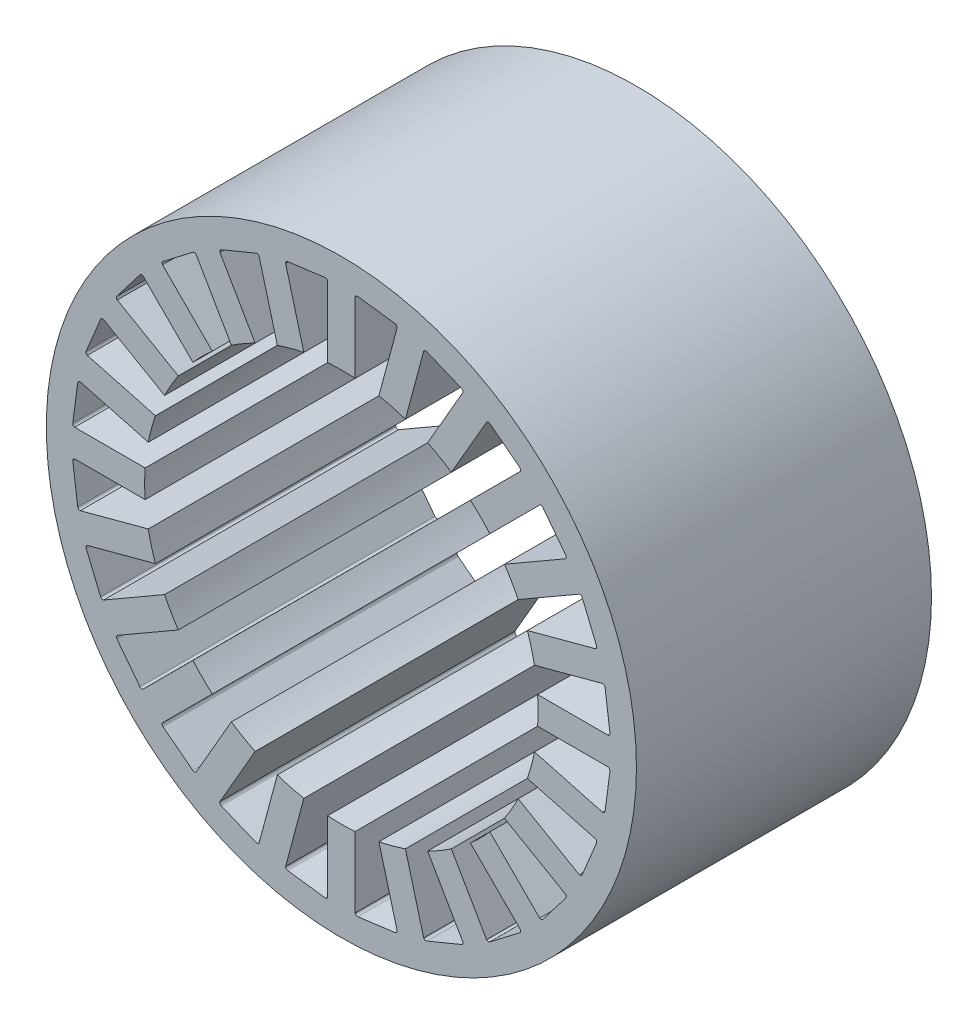
from build123d import *

# Parameters (mm, degrees)
MODEL_R             = 135
BOSS_EXTRUDE1_DEPTH = 135


with BuildPart() as part:
    # Model → Boss-Extrude1 (new body)
    with BuildSketch(Plane.XY):
        Circle(MODEL_R)
        with BuildLine():
            Line((6.278084557, 89.780764389), (6.278084557, 122.02904248))
            ThreePointArc((6.278084557, 122.02904248), (6.722159271, 122.686496505), (7.489003639, 122.889961149))
            Line((7.489003639, 122.889961149), (24.57244037, 120.640884036))
            ThreePointArc((24.57244037, 120.640884036), (25.260494624, 120.245878355), (25.519276236, 119.495891539))
            Line((25.519276236, 119.495891539), (17.172807695, 88.346446878))
            ThreePointArc((17.172807695, 88.346446878), (23.293714059, 86.933324366), (29.301135721, 85.096671177))
            Line((29.301135721, 85.096671177), (37.647604263, 116.246115839))
            ThreePointArc((37.647604263, 116.246115839), (38.24670912, 116.766232668), (39.040084425, 116.764290495))
            Line((39.040084425, 116.764290495), (54.959313175, 110.170330045))
            ThreePointArc((54.959313175, 110.170330045), (55.521687556, 109.61070231), (55.577540527, 108.819293066))
            Line((55.577540527, 108.819293066), (39.453401481, 80.891465011))
            ThreePointArc((39.453401481, 80.891465011), (45, 77.942286341), (50.327362908, 74.613380454))
            Line((50.327362908, 74.613380454), (66.451501953, 102.541208509))
            ThreePointArc((66.451501953, 102.541208509), (67.164808949, 102.888543039), (67.930647975, 102.681326406))
            Line((67.930647975, 102.681326406), (81.600799611, 92.191850126))
            ThreePointArc((81.600799611, 92.191850126), (81.999169234, 91.505738043), (81.848287277, 90.726839603))
            Line((81.848287277, 90.726839603), (59.045311157, 67.923863483))
            ThreePointArc((59.045311157, 67.923863483), (63.639610307, 63.639610307), (67.923863483, 59.045311157))
            Line((67.923863483, 59.045311157), (90.726839602, 81.848287277))
            ThreePointArc((90.726839602, 81.848287277), (91.505738043, 81.999169234), (92.191850126, 81.600799611))
            Line((92.191850126, 81.600799611), (102.681326406, 67.930647975))
            ThreePointArc((102.681326406, 67.930647975), (102.888543039, 67.164808949), (102.541208509, 66.451501953))
            Line((102.541208509, 66.451501953), (74.613380454, 50.327362908))
            ThreePointArc((74.613380454, 50.327362908), (77.942286341, 45), (80.89146501, 39.453401482))
            Line((80.89146501, 39.453401482), (108.819293066, 55.577540527))
            ThreePointArc((108.819293066, 55.577540527), (109.61070231, 55.521687556), (110.170330045, 54.959313175))
            Line((110.170330045, 54.959313175), (116.764290495, 39.040084425))
            ThreePointArc((116.764290495, 39.040084425), (116.766232668, 38.24670912), (116.246115839, 37.647604263))
            Line((116.246115839, 37.647604263), (85.096671177, 29.301135721))
            ThreePointArc((85.096671177, 29.301135721), (86.933324366, 23.293714059), (88.346446877, 17.172807695))
            Line((88.346446877, 17.172807695), (119.495891539, 25.519276237))
            ThreePointArc((119.495891539, 25.519276237), (120.245878355, 25.260494625), (120.640884036, 24.57244037))
            Line((120.640884036, 24.57244037), (122.889961149, 7.489003639))
            ThreePointArc((122.889961149, 7.489003639), (122.686496505, 6.722159271), (122.02904248, 6.278084557))
            Line((122.02904248, 6.278084557), (89.780764389, 6.278084557))
            ThreePointArc((89.780764389, 6.278084557), (89.945174398, 3.140955665), (90, 0))
            ThreePointArc((90, 0), (89.945174398, -3.140955665), (89.780764389, -6.278084557))
            Line((89.780764389, -6.278084557), (122.02904248, -6.278084557))
            ThreePointArc((122.02904248, -6.278084557), (122.686496505, -6.722159271), (122.889961149, -7.489003639))
            Line((122.889961149, -7.489003639), (120.640884036, -24.57244037))
            ThreePointArc((120.640884036, -24.57244037), (120.245878355, -25.260494624), (119.495891539, -25.519276236))
            Line((119.495891539, -25.519276236), (88.346446878, -17.172807695))
            ThreePointArc((88.346446878, -17.172807695), (86.933324366, -23.293714059), (85.096671177, -29.301135721))
            Line((85.096671177, -29.301135721), (116.246115839, -37.647604263))
            ThreePointArc((116.246115839, -37.647604263), (116.766232668, -38.24670912), (116.764290495, -39.040084425))
            Line((116.764290495, -39.040084425), (110.170330045, -54.959313175))
            ThreePointArc((110.170330045, -54.959313175), (109.61070231, -55.521687556), (108.819293066, -55.577540527))
            Line((108.819293066, -55.577540527), (80.891465011, -39.453401481))
            ThreePointArc((80.891465011, -39.453401481), (77.942286341, -45), (74.613380454, -50.327362908))
            Line((74.613380454, -50.327362908), (102.541208509, -66.451501953))
            ThreePointArc((102.541208509, -66.451501953), (102.888543039, -67.164808949), (102.681326406, -67.930647975))
            Line((102.681326406, -67.930647975), (92.191850126, -81.600799611))
            ThreePointArc((92.191850126, -81.600799611), (91.505738043, -81.999169234), (90.726839603, -81.848287277))
            Line((90.726839603, -81.848287277), (67.923863483, -59.045311157))
            ThreePointArc((67.923863483, -59.045311157), (63.639610307, -63.639610307), (59.045311157, -67.923863483))
            Line((59.045311157, -67.923863483), (81.848287277, -90.726839602))
            ThreePointArc((81.848287277, -90.726839602), (81.999169234, -91.505738043), (81.600799611, -92.191850126))
            Line((81.600799611, -92.191850126), (67.930647975, -102.681326406))
            ThreePointArc((67.930647975, -102.681326406), (67.164808949, -102.888543039), (66.451501953, -102.541208509))
            Line((66.451501953, -102.541208509), (50.327362908, -74.613380454))
            ThreePointArc((50.327362908, -74.613380454), (45, -77.942286341), (39.453401481, -80.89146501))
            Line((39.453401481, -80.89146501), (55.577540527, -108.819293066))
            ThreePointArc((55.577540527, -108.819293066), (55.521687556, -109.61070231), (54.959313175, -110.170330045))
            Line((54.959313175, -110.170330045), (39.040084425, -116.764290495))
            ThreePointArc((39.040084425, -116.764290495), (38.24670912, -116.766232668), (37.647604263, -116.246115839))
            Line((37.647604263, -116.246115839), (29.301135721, -85.096671177))
            ThreePointArc((29.301135721, -85.096671177), (23.293714059, -86.933324366), (17.172807695, -88.346446877))
            Line((17.172807695, -88.346446877), (25.519276237, -119.495891539))
            ThreePointArc((25.519276237, -119.495891539), (25.260494625, -120.245878355), (24.57244037, -120.640884036))
            Line((24.57244037, -120.640884036), (7.489003639, -122.889961149))
            ThreePointArc((7.489003639, -122.889961149), (6.722159271, -122.686496505), (6.278084557, -122.02904248))
            Line((6.278084557, -122.02904248), (6.278084557, -89.780764389))
            ThreePointArc((6.278084557, -89.780764389), (3.140955665, -89.945174398), (0, -90))
            ThreePointArc((0, -90), (-3.140955665, -89.945174398), (-6.278084557, -89.780764389))
            Line((-6.278084557, -89.780764389), (-6.278084557, -122.02904248))
            ThreePointArc((-6.278084557, -122.02904248), (-6.722159271, -122.686496505), (-7.489003639, -122.889961149))
            Line((-7.489003639, -122.889961149), (-24.57244037, -120.640884036))
            ThreePointArc((-24.57244037, -120.640884036), (-25.260494624, -120.245878355), (-25.519276236, -119.495891539))
            Line((-25.519276236, -119.495891539), (-17.172807695, -88.346446878))
            ThreePointArc((-17.172807695, -88.346446878), (-23.293714059, -86.933324366), (-29.301135721, -85.096671177))
            Line((-29.301135721, -85.096671177), (-37.647604263, -116.246115839))
            ThreePointArc((-37.647604263, -116.246115839), (-38.24670912, -116.766232668), (-39.040084425, -116.764290495))
            Line((-39.040084425, -116.764290495), (-54.959313175, -110.170330045))
            ThreePointArc((-54.959313175, -110.170330045), (-55.521687556, -109.61070231), (-55.577540527, -108.819293066))
            Line((-55.577540527, -108.819293066), (-39.453401481, -80.891465011))
            ThreePointArc((-39.453401481, -80.891465011), (-45, -77.942286341), (-50.327362908, -74.613380454))
            Line((-50.327362908, -74.613380454), (-66.451501953, -102.541208509))
            ThreePointArc((-66.451501953, -102.541208509), (-67.164808949, -102.888543039), (-67.930647975, -102.681326406))
            Line((-67.930647975, -102.681326406), (-81.600799611, -92.191850126))
            ThreePointArc((-81.600799611, -92.191850126), (-81.999169234, -91.505738043), (-81.848287277, -90.726839603))
            Line((-81.848287277, -90.726839603), (-59.045311157, -67.923863483))
            ThreePointArc((-59.045311157, -67.923863483), (-63.639610307, -63.639610307), (-67.923863483, -59.045311157))
            Line((-67.923863483, -59.045311157), (-90.726839602, -81.848287277))
            ThreePointArc((-90.726839602, -81.848287277), (-91.505738043, -81.999169234), (-92.191850126, -81.600799611))
            Line((-92.191850126, -81.600799611), (-102.681326406, -67.930647975))
            ThreePointArc((-102.681326406, -67.930647975), (-102.888543039, -67.164808949), (-102.541208509, -66.451501953))
            Line((-102.541208509, -66.451501953), (-74.613380454, -50.327362908))
            ThreePointArc((-74.613380454, -50.327362908), (-77.942286341, -45), (-80.89146501, -39.453401481))
            Line((-80.89146501, -39.453401481), (-108.819293066, -55.577540527))
            ThreePointArc((-108.819293066, -55.577540527), (-109.61070231, -55.521687556), (-110.170330045, -54.959313175))
            Line((-110.170330045, -54.959313175), (-116.764290495, -39.040084425))
            ThreePointArc((-116.764290495, -39.040084425), (-116.766232668, -38.24670912), (-116.246115839, -37.647604263))
            Line((-116.246115839, -37.647604263), (-85.096671177, -29.301135721))
            ThreePointArc((-85.096671177, -29.301135721), (-86.933324366, -23.293714059), (-88.346446877, -17.172807695))
            Line((-88.346446877, -17.172807695), (-119.495891539, -25.519276237))
            ThreePointArc((-119.495891539, -25.519276237), (-120.245878355, -25.260494625), (-120.640884036, -24.57244037))
            Line((-120.640884036, -24.57244037), (-122.889961149, -7.489003639))
            ThreePointArc((-122.889961149, -7.489003639), (-122.686496505, -6.722159271), (-122.02904248, -6.278084557))
            Line((-122.02904248, -6.278084557), (-89.780764389, -6.278084557))
            ThreePointArc((-89.780764389, -6.278084557), (-89.945174398, -3.140955665), (-90, 0))
            ThreePointArc((-90, 0), (-89.945174398, 3.140955665), (-89.780764389, 6.278084557))
            Line((-89.780764389, 6.278084557), (-122.02904248, 6.278084557))
            ThreePointArc((-122.02904248, 6.278084557), (-122.686496505, 6.722159271), (-122.889961149, 7.489003639))
            Line((-122.889961149, 7.489003639), (-120.640884036, 24.57244037))
            ThreePointArc((-120.640884036, 24.57244037), (-120.245878355, 25.260494624), (-119.495891539, 25.519276236))
            Line((-119.495891539, 25.519276236), (-88.346446878, 17.172807695))
            ThreePointArc((-88.346446878, 17.172807695), (-86.933324366, 23.293714059), (-85.096671177, 29.301135721))
            Line((-85.096671177, 29.301135721), (-116.246115839, 37.647604263))
            ThreePointArc((-116.246115839, 37.647604263), (-116.766232668, 38.24670912), (-116.764290495, 39.040084425))
            Line((-116.764290495, 39.040084425), (-110.170330045, 54.959313175))
            ThreePointArc((-110.170330045, 54.959313175), (-109.61070231, 55.521687556), (-108.819293066, 55.577540527))
            Line((-108.819293066, 55.577540527), (-80.891465011, 39.453401481))
            ThreePointArc((-80.891465011, 39.453401481), (-77.942286341, 45), (-74.613380454, 50.327362908))
            Line((-74.613380454, 50.327362908), (-102.541208509, 66.451501953))
            ThreePointArc((-102.541208509, 66.451501953), (-102.888543039, 67.164808949), (-102.681326406, 67.930647975))
            Line((-102.681326406, 67.930647975), (-92.191850126, 81.600799611))
            ThreePointArc((-92.191850126, 81.600799611), (-91.505738043, 81.999169234), (-90.726839603, 81.848287277))
            Line((-90.726839603, 81.848287277), (-67.923863483, 59.045311157))
            ThreePointArc((-67.923863483, 59.045311157), (-63.639610307, 63.639610307), (-59.045311157, 67.923863483))
            Line((-59.045311157, 67.923863483), (-81.848287277, 90.726839602))
            ThreePointArc((-81.848287277, 90.726839602), (-81.999169234, 91.505738043), (-81.600799611, 92.191850126))
            Line((-81.600799611, 92.191850126), (-67.930647975, 102.681326406))
            ThreePointArc((-67.930647975, 102.681326406), (-67.164808949, 102.888543039), (-66.451501953, 102.541208509))
            Line((-66.451501953, 102.541208509), (-50.327362908, 74.613380454))
            ThreePointArc((-50.327362908, 74.613380454), (-45, 77.942286341), (-39.453401482, 80.89146501))
            Line((-39.453401482, 80.89146501), (-55.577540527, 108.819293066))
            ThreePointArc((-55.577540527, 108.819293066), (-55.521687556, 109.61070231), (-54.959313175, 110.170330045))
            Line((-54.959313175, 110.170330045), (-39.040084425, 116.764290495))
            ThreePointArc((-39.040084425, 116.764290495), (-38.24670912, 116.766232668), (-37.647604263, 116.246115839))
            Line((-37.647604263, 116.246115839), (-29.301135721, 85.096671177))
            ThreePointArc((-29.301135721, 85.096671177), (-23.293714059, 86.933324366), (-17.172807695, 88.346446877))
            Line((-17.172807695, 88.346446877), (-25.519276237, 119.495891539))
            ThreePointArc((-25.519276237, 119.495891539), (-25.260494625, 120.245878355), (-24.57244037, 120.640884036))
            Line((-24.57244037, 120.640884036), (-7.489003639, 122.889961149))
            ThreePointArc((-7.489003639, 122.889961149), (-6.722159271, 122.686496505), (-6.278084557, 122.02904248))
            Line((-6.278084557, 122.02904248), (-6.278084557, 89.780764389))
            ThreePointArc((-6.278084557, 89.780764389), (-3.140955665, 89.945174398), (0, 90))
            ThreePointArc((0, 90), (3.140955665, 89.945174398), (6.278084557, 89.780764389))
        make_face(mode=Mode.SUBTRACT)
    extrude(amount=BOSS_EXTRUDE1_DEPTH)


solid = part.part
